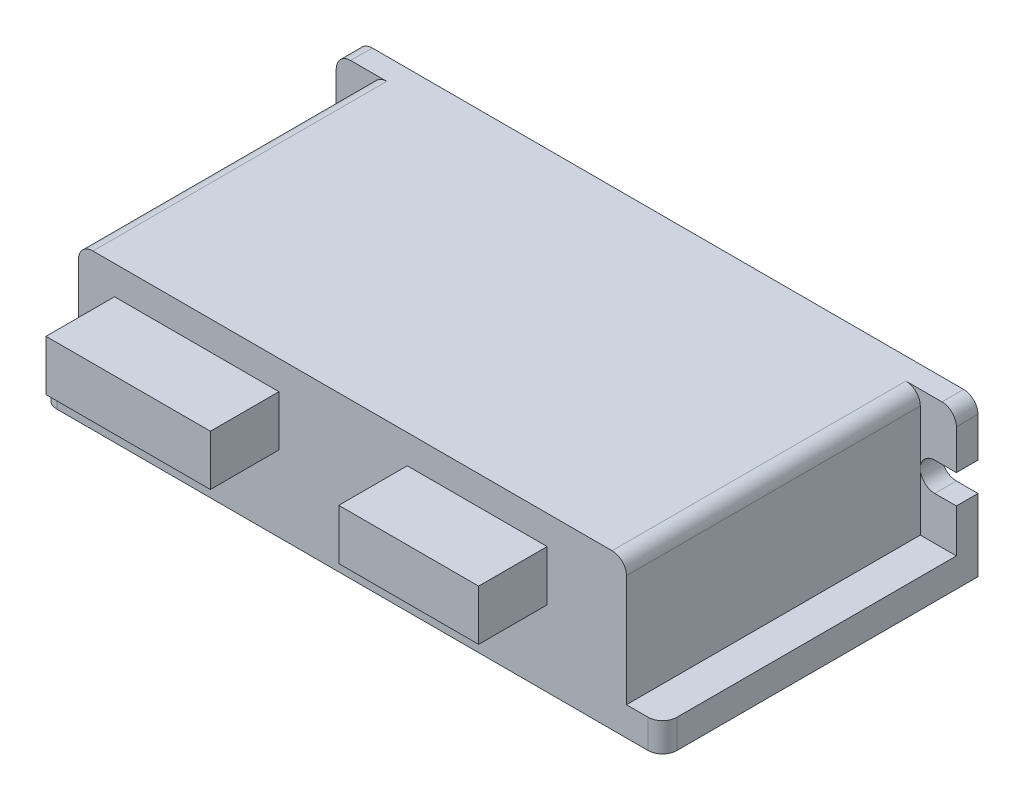
from build123d import *

# Parameters (mm, degrees)
SKETCH1_W           = 86
SKETCH1_H           = 21.5
BOSS_EXTRUDE1_DEPTH = 43.75
SKETCH2_W           = 5
SKETCH2_H           = 17.5
CUT_EXTRUDE1_DEPTH  = 40.75
CUT_EXTRUDE2_DEPTH  = 63.278607884
FILLET1_R           = 2
SKETCH4_W           = 22.8
SKETCH4_H           = 7
SKETCH4_W_2         = 19.4
BOSS_EXTRUDE2_DEPTH = 9.5


with BuildPart() as part:
    # Sketch1 → Boss-Extrude1 (new body)
    with BuildSketch(Plane.XY):
        Rectangle(SKETCH1_W, SKETCH1_H)
    extrude(amount=BOSS_EXTRUDE1_DEPTH)

    # Sketch2 → Cut-Extrude1 (cut)
    with BuildSketch(Plane.XY.offset(43.75)):
        with Locations((-40.5, 2)):
            Rectangle(SKETCH2_W, SKETCH2_H)
        with Locations((40.5, 2)):
            Rectangle(SKETCH2_W, SKETCH2_H)
    extrude(amount=-CUT_EXTRUDE1_DEPTH, mode=Mode.SUBTRACT)

    # Sketch3 → Cut-Extrude2 (cut, through all)
    with BuildSketch(Plane(origin=(0, 0, 0), x_dir=(-1, 0, 0), z_dir=(0, 0, -1))):
        with BuildLine():
            Line((40, 3.25), (47.671145092, 3.25))
            ThreePointArc((47.671145092, 3.25), (49.671145092, 1.25), (47.671145092, -0.75))
            Line((47.671145092, -0.75), (40, -0.75))
            ThreePointArc((40, -0.75), (38, 1.25), (40, 3.25))
        make_face()
        with BuildLine():
            Line((-40, 3.25), (-47.671145092, 3.25))
            ThreePointArc((-47.671145092, 3.25), (-49.671145092, 1.25), (-47.671145092, -0.75))
            Line((-47.671145092, -0.75), (-40, -0.75))
            ThreePointArc((-40, -0.75), (-38, 1.25), (-40, 3.25))
        make_face()
    extrude(amount=-CUT_EXTRUDE2_DEPTH, mode=Mode.SUBTRACT)

    # Fillet1
    fillet1_edges = [part.edges().sort_by_distance(p)[0] for p in [
        (-43, -8.75, 43.75),
        (-43, 10.75, 1.5),
        (43, 10.75, 1.5),
        (-38, 10.75, 23.375),
        (38, 10.75, 23.375),
        (43, -8.75, 43.75),
    ]]
    fillet(fillet1_edges, radius=FILLET1_R)

    # Sketch4 → Boss-Extrude2 (add)
    with BuildSketch(Plane.XY.offset(43.75)):
        with Locations((-21.6, 3.25)):
            Rectangle(SKETCH4_W, SKETCH4_H)
        with Locations((17.3, 3.25)):
            Rectangle(SKETCH4_W_2, SKETCH4_H)
    extrude(amount=BOSS_EXTRUDE2_DEPTH)


solid = part.part
